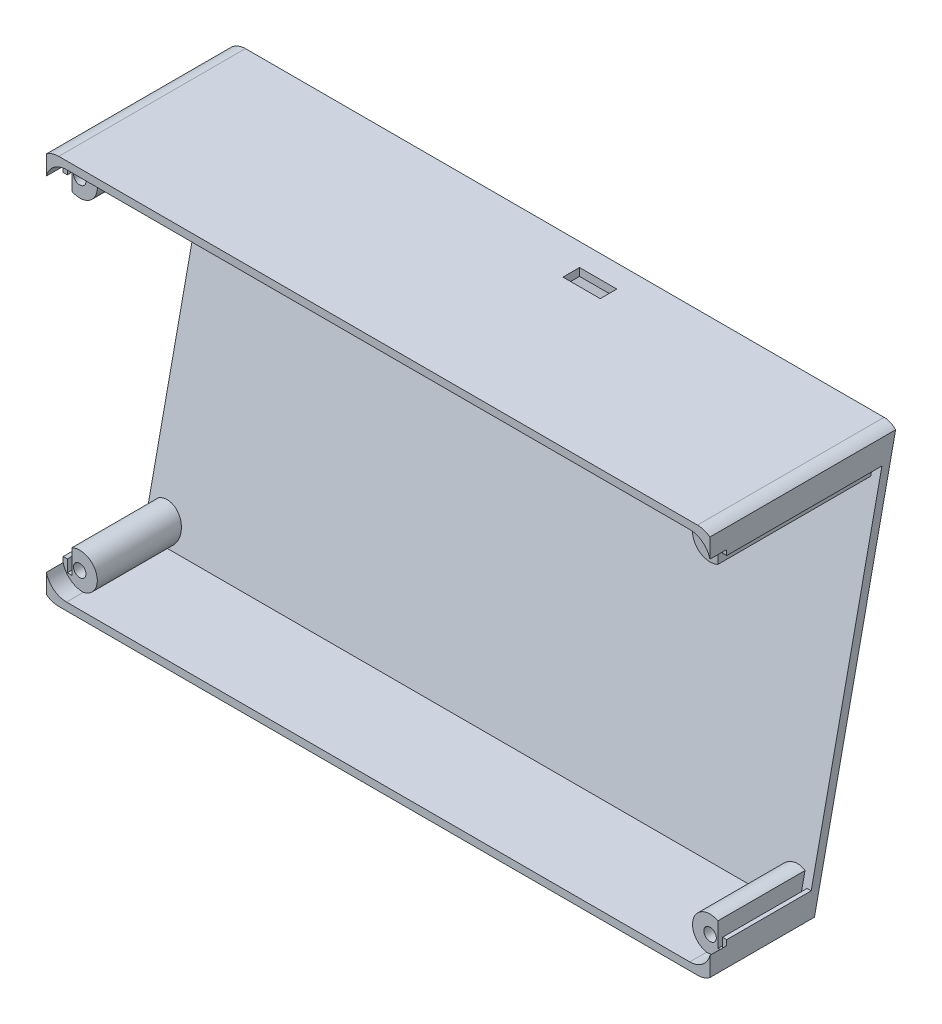
from build123d import *

# Parameters (mm, degrees)
SKIZZE1_W                       = 164
SKIZZE1_H                       = 94
AUFSATZ_LINEAR_AUSTRAGEN1_DEPTH = 25
AUFSATZ_LINEAR_AUSTRAGEN2_DEPTH = 164
SCHNITT_LINEAR_AUSTRAGEN1_REACH = 106.68
AUFSATZ_LINEAR_AUSTRAGEN3_REACH = 106.68
SKIZZE4_R                       = 4.236153916
SKIZZE4_R_2                     = 1.5
SCHNITT_LINEAR_AUSTRAGEN2_DEPTH = 4.05
VERRUNDUNG1_R                   = 5
SKIZZE7_W                       = 9
SKIZZE7_H                       = 4
SCHNITT_LINEAR_AUSTRAGEN4_DEPTH = 4.05
SKIZZE8_R                       = 5.5
SCHNITT_LINEAR_AUSTRAGEN5_DEPTH = 1
SKIZZE9_W                       = 47.666626173
SKIZZE9_H                       = 143.1878039
SKIZZE9_W_2                     = 41.660611838
SCHNITT_LINEAR_AUSTRAGEN6_DEPTH = 105.680466182
SCHNITT_LINEAR_AUSTRAGEN7_REACH = 103.419


with BuildPart() as part:
    # Skizze1 → Aufsatz-Linear austragen1 (new body)
    with BuildSketch(Plane.XY):
        Rectangle(SKIZZE1_W, SKIZZE1_H)
    extrude(amount=AUFSATZ_LINEAR_AUSTRAGEN1_DEPTH)

    # Skizze2 → Aufsatz-Linear austragen2 (add)
    with BuildSketch(Plane(origin=(82, 0, 0), x_dir=(0, 0, -1), z_dir=(1, 0, 0))):
        Polygon((0, -47), (0, 47), (20, 47), align=None)
    extrude(amount=-AUFSATZ_LINEAR_AUSTRAGEN2_DEPTH)

    # Schnitt-Linear austragen1: up to this plane
    schnitt_linear_austragen1_end = Plane(origin=(-82, 47.416215289, -18.043788142), z_dir=(0, -0.20810764446485866, -0.9781059289848355))
    # Skizze3 → Schnitt-Linear austragen1 (cut, up to the surface)
    with BuildSketch(Plane.XY.offset(25), mode=Mode.PRIVATE) as schnitt_linear_austragen1_sk1:
        with BuildLine():
            Line((-75.15, -45.15), (75.15, -45.15))
            ThreePointArc((75.15, -45.15), (78.685533906, -43.685533906), (80.15, -40.15))
            Line((80.15, -40.15), (80.15, 40.15))
            ThreePointArc((80.15, 40.15), (78.685533906, 43.685533906), (75.15, 45.15))
            Line((75.15, 45.15), (-75.15, 45.15))
            ThreePointArc((-75.15, 45.15), (-78.685533906, 43.685533906), (-80.15, 40.15))
            Line((-80.15, 40.15), (-80.15, -40.15))
            ThreePointArc((-80.15, -40.15), (-78.685533906, -43.685533906), (-75.15, -45.15))
        make_face()
    schnitt_linear_austragen1_tool1 = split(extrude(schnitt_linear_austragen1_sk1.sketch, amount=-SCHNITT_LINEAR_AUSTRAGEN1_REACH, mode=Mode.PRIVATE), bisect_by=schnitt_linear_austragen1_end, keep=Keep.BOTH, mode=Mode.PRIVATE)
    add(schnitt_linear_austragen1_tool1.solids().sort_by_distance((0, 0, 25))[0], mode=Mode.SUBTRACT)

    # Aufsatz-Linear austragen3: up to this plane
    aufsatz_linear_austragen3_end = Plane(origin=(-82, 47.416215289, -18.043788142), z_dir=(0, -0.20810764446485866, -0.9781059289848355))
    # Skizze4 → Aufsatz-Linear austragen3 (add, up to the surface)
    with BuildSketch(Plane.XY.offset(25), mode=Mode.PRIVATE) as aufsatz_linear_austragen3_sk1:
        with Locations((-76, 41)):
            Circle(SKIZZE4_R)
        with Locations((-76, 41)):
            Circle(SKIZZE4_R_2, mode=Mode.SUBTRACT)
    aufsatz_linear_austragen3_tool1 = split(extrude(aufsatz_linear_austragen3_sk1.sketch, amount=-AUFSATZ_LINEAR_AUSTRAGEN3_REACH, mode=Mode.PRIVATE), bisect_by=aufsatz_linear_austragen3_end, keep=Keep.BOTH, mode=Mode.PRIVATE)
    add(aufsatz_linear_austragen3_tool1.solids().sort_by_distance((-80.116337, 41, 25))[0])
    # Skizze4 → Aufsatz-Linear austragen3 (add, up to the surface)
    with BuildSketch(Plane.XY.offset(25), mode=Mode.PRIVATE) as aufsatz_linear_austragen3_sk2:
        with Locations((-76, -41)):
            Circle(SKIZZE4_R)
        with Locations((-76, -41)):
            Circle(SKIZZE4_R_2, mode=Mode.SUBTRACT)
    aufsatz_linear_austragen3_tool2 = split(extrude(aufsatz_linear_austragen3_sk2.sketch, amount=-AUFSATZ_LINEAR_AUSTRAGEN3_REACH, mode=Mode.PRIVATE), bisect_by=aufsatz_linear_austragen3_end, keep=Keep.BOTH, mode=Mode.PRIVATE)
    add(aufsatz_linear_austragen3_tool2.solids().sort_by_distance((-80.116337, -41, 25))[0])
    # Skizze4 → Aufsatz-Linear austragen3 (add, up to the surface)
    with BuildSketch(Plane.XY.offset(25), mode=Mode.PRIVATE) as aufsatz_linear_austragen3_sk3:
        with Locations((76, -41)):
            Circle(SKIZZE4_R)
        with Locations((76, -41)):
            Circle(SKIZZE4_R_2, mode=Mode.SUBTRACT)
    aufsatz_linear_austragen3_tool3 = split(extrude(aufsatz_linear_austragen3_sk3.sketch, amount=-AUFSATZ_LINEAR_AUSTRAGEN3_REACH, mode=Mode.PRIVATE), bisect_by=aufsatz_linear_austragen3_end, keep=Keep.BOTH, mode=Mode.PRIVATE)
    add(aufsatz_linear_austragen3_tool3.solids().sort_by_distance((71.883663, -41, 25))[0])
    # Skizze4 → Aufsatz-Linear austragen3 (add, up to the surface)
    with BuildSketch(Plane.XY.offset(25), mode=Mode.PRIVATE) as aufsatz_linear_austragen3_sk4:
        with Locations((76, 41)):
            Circle(SKIZZE4_R)
        with Locations((76, 41)):
            Circle(SKIZZE4_R_2, mode=Mode.SUBTRACT)
    aufsatz_linear_austragen3_tool4 = split(extrude(aufsatz_linear_austragen3_sk4.sketch, amount=-AUFSATZ_LINEAR_AUSTRAGEN3_REACH, mode=Mode.PRIVATE), bisect_by=aufsatz_linear_austragen3_end, keep=Keep.BOTH, mode=Mode.PRIVATE)
    add(aufsatz_linear_austragen3_tool4.solids().sort_by_distance((71.883663, 41, 25))[0])

    # Skizze6 → Schnitt-Linear austragen2 (cut)
    with BuildSketch(Plane.XY.offset(25)):
        with BuildLine():
            Line((-75.15, -45.15), (75.15, -45.15))
            ThreePointArc((75.15, -45.15), (78.685533906, -43.685533906), (80.15, -40.15))
            Line((80.15, -40.15), (80.15, 40.15))
            ThreePointArc((80.15, 40.15), (78.685533906, 43.685533906), (75.15, 45.15))
            Line((75.15, 45.15), (-75.15, 45.15))
            ThreePointArc((-75.15, 45.15), (-78.685533906, 43.685533906), (-80.15, 40.15))
            Line((-80.15, 40.15), (-80.15, -40.15))
            ThreePointArc((-80.15, -40.15), (-78.685533906, -43.685533906), (-75.15, -45.15))
        make_face()
    extrude(amount=-SCHNITT_LINEAR_AUSTRAGEN2_DEPTH, mode=Mode.SUBTRACT)

    # Verrundung1
    verrundung1_edges = [part.edges().sort_by_distance(p)[0] for p in [
        (82, -47, 12.5),
        (-82, -47, 12.5),
        (-82, 47, 2.5),
        (82, 47, 2.5),
    ]]
    fillet(verrundung1_edges, radius=VERRUNDUNG1_R)

    # Skizze7 → Schnitt-Linear austragen4 (cut)
    with BuildSketch(Plane(origin=(0, 47, 0), x_dir=(1, 0, 0), z_dir=(0, 1, 0))):
        with Locations((13.5, 12.561614676)):
            Rectangle(SKIZZE7_W, SKIZZE7_H)
    extrude(amount=-SCHNITT_LINEAR_AUSTRAGEN4_DEPTH, mode=Mode.SUBTRACT)

    # Skizze8 → Schnitt-Linear austragen5 (cut)
    with BuildSketch(Plane(origin=(0, -2.035513209, -9.566912083), x_dir=(-1, 0, 0), z_dir=(0, -0.20810764446485866, -0.9781059289848355))):
        with Locations(Location((-72, 40.133131552, 0), (0, 0, 90))):
            Circle(SKIZZE8_R)
        with Locations(Location((72, 40.133131552, 0), (0, 0, 90))):
            Circle(SKIZZE8_R)
        with Locations(Location((72, -35.970978662, 0), (0, 0, 90))):
            Circle(SKIZZE8_R)
        with Locations(Location((-72, -35.970978662, 0), (0, 0, 90))):
            Circle(SKIZZE8_R)
    extrude(amount=-SCHNITT_LINEAR_AUSTRAGEN5_DEPTH, mode=Mode.SUBTRACT)

    # Skizze9 → Schnitt-Linear austragen6 (cut, through all)
    with BuildSketch(Plane.XY.offset(25)):
        with Locations((103.833313086, 0)):
            Rectangle(SKIZZE9_W, SKIZZE9_H)
        with Locations((-100.830305919, 0)):
            Rectangle(SKIZZE9_W_2, SKIZZE9_H)
    extrude(amount=-SCHNITT_LINEAR_AUSTRAGEN6_DEPTH, mode=Mode.SUBTRACT)

    # Schnitt-Linear austragen7: up to this plane
    schnitt_linear_austragen7_end = Plane(origin=(-82, 47.416215289, -18.043788142), z_dir=(0, -0.20810764446485866, -0.9781059289848355))
    # Skizze11 → Schnitt-Linear austragen7 (cut, up to the surface)
    with BuildSketch(Plane.XY.offset(20.95), mode=Mode.PRIVATE) as schnitt_linear_austragen7_sk1:
        Polygon((-77.9, 43), (-79, 43), (-79, 40.1), (-80, 40.1), (-80, -40.1), (-79, -40.1), (-79, -43), (-77.9, -43), align=None)
    schnitt_linear_austragen7_tool1 = split(extrude(schnitt_linear_austragen7_sk1.sketch, amount=-SCHNITT_LINEAR_AUSTRAGEN7_REACH, mode=Mode.PRIVATE), bisect_by=schnitt_linear_austragen7_end, keep=Keep.BOTH, mode=Mode.PRIVATE)
    add(schnitt_linear_austragen7_tool1.solids().sort_by_distance((-78.931751, 0, 20.95))[0], mode=Mode.SUBTRACT)
    # Skizze11 → Schnitt-Linear austragen7 (cut, up to the surface)
    with BuildSketch(Plane.XY.offset(20.95), mode=Mode.PRIVATE) as schnitt_linear_austragen7_sk2:
        Polygon((80, 40.1), (80, -40.1), (79, -40.1), (79, -43), (77.9, -43), (77.9, 43), (79, 43), (79, 40.1), align=None)
    schnitt_linear_austragen7_tool2 = split(extrude(schnitt_linear_austragen7_sk2.sketch, amount=-SCHNITT_LINEAR_AUSTRAGEN7_REACH, mode=Mode.PRIVATE), bisect_by=schnitt_linear_austragen7_end, keep=Keep.BOTH, mode=Mode.PRIVATE)
    add(schnitt_linear_austragen7_tool2.solids().sort_by_distance((78.931751, 0, 20.95))[0], mode=Mode.SUBTRACT)


solid = part.part
